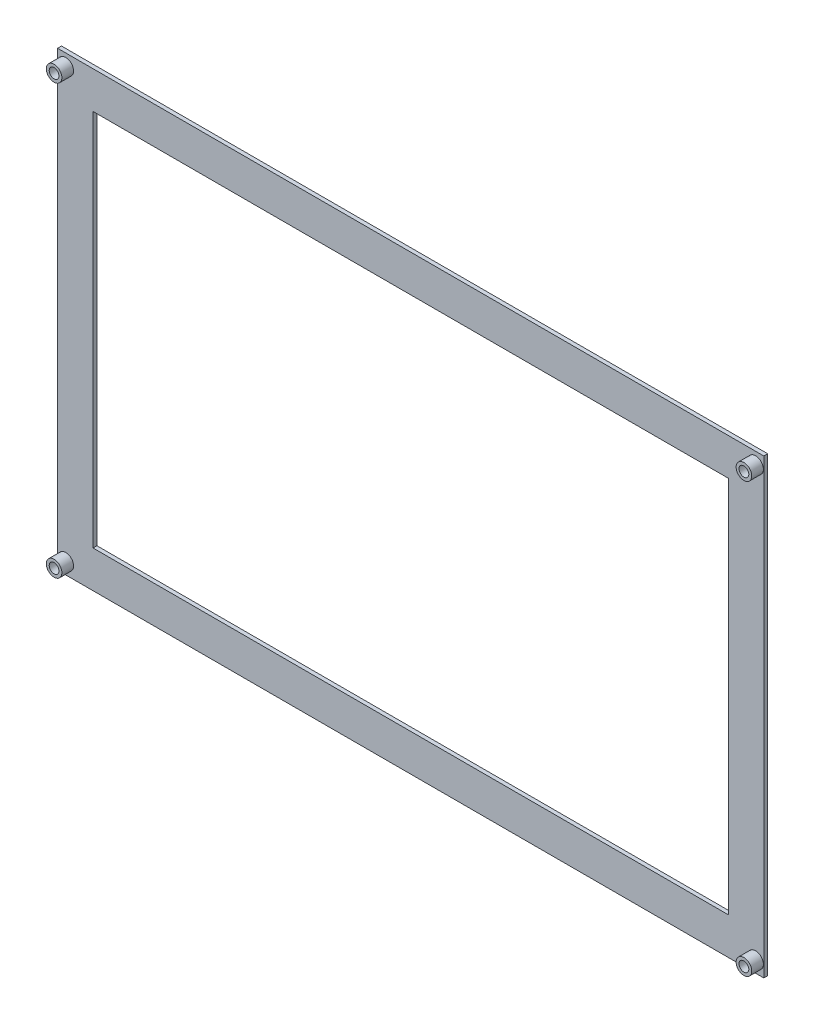
from build123d import *

# Parameters (mm, degrees)
SKETCH_1_W          = 181.2
SKETCH_1_H          = 116
EXTRUDE_1_DEPTH     = 1
SKETCH_2_R          = 2
SKETCH_2_R_2        = 1.25
EXTRUDE_2_DEPTH     = 3
SKETCH_3_W          = 163
SKETCH_3_H          = 97
CUT_EXTRUDE_2_DEPTH = 3


with BuildPart() as part:
    # 草图1 → 凸台-拉伸1 (new body)
    with BuildSketch(Plane.XY):
        Rectangle(SKETCH_1_W, SKETCH_1_H)
    extrude(amount=EXTRUDE_1_DEPTH)

    # 草图2 → 凸台-拉伸2 (add)
    # profile 1 of 4: a face of its own
    with BuildSketch(Plane.XY.offset(1)):
        with Locations((-88.5, 55)):
            Circle(SKETCH_2_R)
        with Locations((-88.5, 55)):
            Circle(SKETCH_2_R_2, mode=Mode.SUBTRACT)
    # profile 2 of 4: a face of its own
    with BuildSketch(Plane.XY.offset(1)):
        with Locations((88.5, 55)):
            Circle(SKETCH_2_R)
        with Locations((88.5, 55)):
            Circle(SKETCH_2_R_2, mode=Mode.SUBTRACT)
    # profile 3 of 4: a face of its own
    with BuildSketch(Plane.XY.offset(1)):
        with Locations((88.5, -55)):
            Circle(SKETCH_2_R)
        with Locations((88.5, -55)):
            Circle(SKETCH_2_R_2, mode=Mode.SUBTRACT)
    # profile 4 of 4: a face of its own
    with BuildSketch(Plane.XY.offset(1)):
        with Locations((-88.5, -55)):
            Circle(SKETCH_2_R)
        with Locations((-88.5, -55)):
            Circle(SKETCH_2_R_2, mode=Mode.SUBTRACT)
    extrude(amount=EXTRUDE_2_DEPTH)

    # 草图3 → 切除-拉伸2 (cut)
    with BuildSketch(Plane(origin=(0, 0, 0), x_dir=(-1, 0, 0), z_dir=(0, 0, -1))):
        Rectangle(SKETCH_3_W, SKETCH_3_H)
    extrude(amount=-CUT_EXTRUDE_2_DEPTH, mode=Mode.SUBTRACT)


solid = part.part
